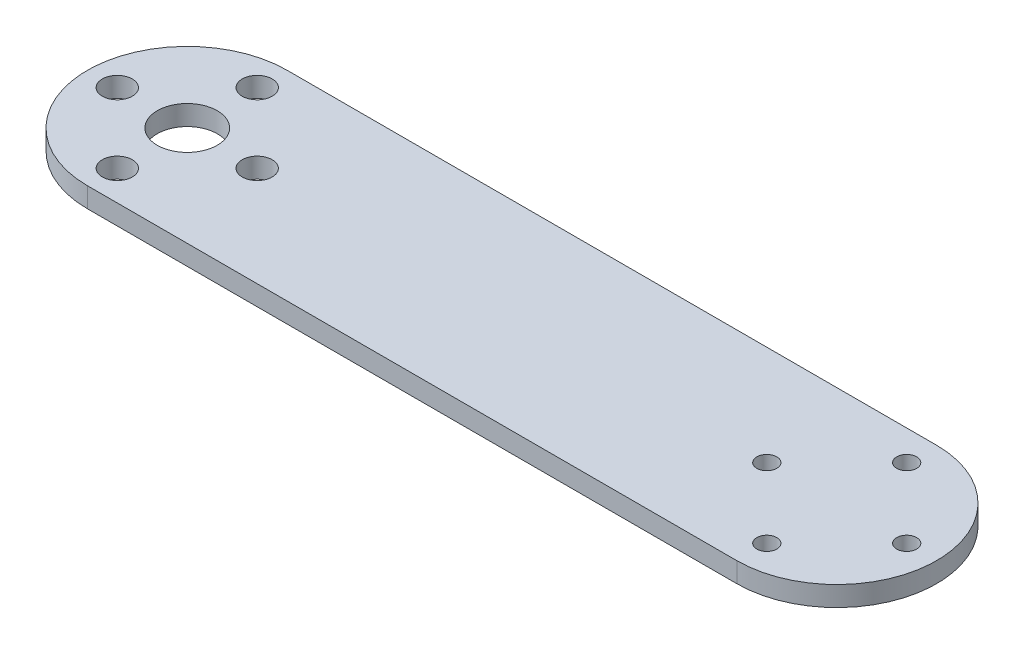
from build123d import *

# Parameters (mm, degrees)
SKETCH_1_R      = 1.5
SKETCH_1_R_2    = 1
SKETCH_1_R_3    = 3
EXTRUDE_1_DEPTH = 2


with BuildPart() as part:
    # Эскиз1 → Бобышка-Вытянуть1 (new body)
    with BuildSketch(Plane(origin=(0, 0, 0), x_dir=(1, 0, 0), z_dir=(0, 1, 0))):
        with BuildLine():
            Line((0, 10), (65, 10))
            ThreePointArc((65, 10), (75, 0), (65, -10))
            Line((65, -10), (0, -10))
            ThreePointArc((0, -10), (-10, 0), (0, 10))
        make_face()
        with Locations(Location((0, 7, 0), (0, 0, 270))):
            Circle(SKETCH_1_R, mode=Mode.SUBTRACT)
        with Locations(Location((7, 0, 0), (0, 0, 270))):
            Circle(SKETCH_1_R, mode=Mode.SUBTRACT)
        with Locations(Location((0, -7, 0), (0, 0, 270))):
            Circle(SKETCH_1_R, mode=Mode.SUBTRACT)
        with Locations(Location((-7, 0, 0), (0, 0, 270))):
            Circle(SKETCH_1_R, mode=Mode.SUBTRACT)
        with Locations(Location((65, 7, 0), (0, 0, 270))):
            Circle(SKETCH_1_R_2, mode=Mode.SUBTRACT)
        with Locations(Location((72, 0, 0), (0, 0, 270))):
            Circle(SKETCH_1_R_2, mode=Mode.SUBTRACT)
        with Locations(Location((65, -7, 0), (0, 0, 270))):
            Circle(SKETCH_1_R_2, mode=Mode.SUBTRACT)
        with Locations(Location((58, 0, 0), (0, 0, 270))):
            Circle(SKETCH_1_R_2, mode=Mode.SUBTRACT)
        with Locations(Location((0, 0, 0), (0, 0, 270))):
            Circle(SKETCH_1_R_3, mode=Mode.SUBTRACT)
    extrude(amount=EXTRUDE_1_DEPTH)


solid = part.part
